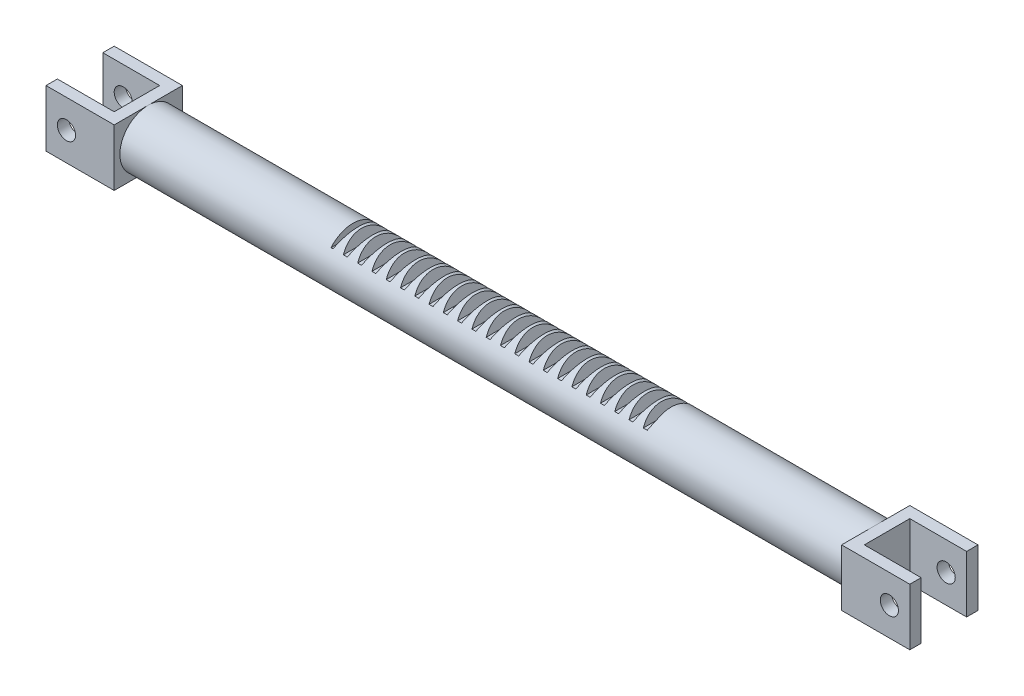
from build123d import *

# Parameters (mm, degrees)
BOSS_EXTRUDE1_DEPTH = 30
SKETCH2_R           = 30
SKETCH2_R_2         = 12.5
CUT_EXTRUDE1_DEPTH  = 146.129146151
BOSS_EXTRUDE2_START = 90
SKETCH3_R           = 12.5
BOSS_EXTRUDE2_DEPTH = 90
BOSS_EXTRUDE3_START = -140
SKETCH3_2_R         = 12.5
BOSS_EXTRUDE3_DEPTH = 90
SKETCH4_W           = 30
SKETCH4_H           = 25
BOSS_EXTRUDE4_DEPTH = 5
SKETCH8_W           = 30
SKETCH8_H           = 5
BOSS_EXTRUDE7_DEPTH = 25
SKETCH9_R           = 4
CUT_EXTRUDE2_DEPTH  = 242.111266906


with BuildPart() as part:
    # Sketch1 → Boss-Extrude1 (new body)
    with BuildSketch(Plane.XY):
        Polygon((20.439052972, 3.783569778), (18.715311494, 3.783569778), (17.077445439, 8.283569778), (15.793733726, 8.283569778), (14.155867672, 3.783569778), (12.432126194, 3.783569778), (10.794260139, 8.283569778), (9.510548426, 8.283569778), (7.872682372, 3.783569778), (6.148940894, 3.783569778), (4.511074839, 8.283569778), (3.227363126, 8.283569778), (1.589497072, 3.783569778), (-0.134244406, 3.783569778), (-1.772110461, 8.283569778), (-3.055822174, 8.283569778), (-4.693688228, 3.783569778), (-6.417429706, 3.783569778), (-8.055295761, 8.283569778), (-9.339007474, 8.283569778), (-10.976873528, 3.783569778), (-12.700615006, 3.783569778), (-14.338481061, 8.283569778), (-15.622192774, 8.283569778), (-17.260058828, 3.783569778), (-18.983800306, 3.783569778), (-20.621666361, 8.283569778), (-21.905378074, 8.283569778), (-23.543244128, 3.783569778), (-25.266985606, 3.783569778), (-26.904851661, 8.283569778), (-28.188563374, 8.283569778), (-29.826429428, 3.783569778), (-31.550170906, 3.783569778), (-33.188036961, 8.283569778), (-34.471748674, 8.283569778), (-36.109614728, 3.783569778), (-37.833356206, 3.783569778), (-39.471222261, 8.283569778), (-40.754933974, 8.283569778), (-42.392800028, 3.783569778), (-44.116541506, 3.783569778), (-45.754407561, 8.283569778), (-47.038119274, 8.283569778), (-48.675985328, 3.783569778), (-50.399726806, 3.783569778), (-52.037592861, 8.283569778), (-53.321304574, 8.283569778), (-54.959170628, 3.783569778), (-56.682912106, 3.783569778), (-58.320778161, 8.283569778), (-59.604489874, 8.283569778), (-61.242355928, 3.783569778), (-62.966097406, 3.783569778), (-64.603963461, 8.283569778), (-65.887675174, 8.283569778), (-67.525541228, 3.783569778), (-69.249282706, 3.783569778), (-70.887148761, 8.283569778), (-72.170860474, 8.283569778), (-73.808726528, 3.783569778), (-75.532468006, 3.783569778), (-77.170334061, 8.283569778), (-78.454045774, 8.283569778), (-80.091911828, 3.783569778), (-81.815653306, 3.783569778), (-83.453519361, 8.283569778), (-84.737231074, 8.283569778), (-86.375097128, 3.783569778), (-88.098838606, 3.783569778), (-89.736704661, 8.283569778), (-91.020416374, 8.283569778), (-92.658282428, 3.783569778), (-94.382023906, 3.783569778), (-96.019889961, 8.283569778), (-97.303601674, 8.283569778), (-98.941467728, 3.783569778), (-100.665209206, 3.783569778), (-102.303075261, 8.283569778), (-103.586786974, 8.283569778), (-105.224653028, 3.783569778), (-106.948394506, 3.783569778), (-108.586260561, 8.283569778), (-109.869972274, 8.283569778), (-111.507838328, 3.783569778), (-113.231579806, 3.783569778), (-114.869445861, 8.283569778), (-116.153157574, 8.283569778), (-117.791023628, 3.783569778), (-118.652894367, 3.783569778), (-118.652894367, -23.716430222), (21.347105633, -23.716430222), (21.347105633, 6.278423959), align=None)
    extrude(amount=BOSS_EXTRUDE1_DEPTH)

    # Sketch2 → Cut-Extrude1 (cut, through all)
    with BuildSketch(Plane.ZY.offset(118.652894367)):
        with Locations((15, -4.216430222)):
            Circle(SKETCH2_R)
        with Locations((15, -4.216430222)):
            Circle(SKETCH2_R_2, mode=Mode.SUBTRACT)
    extrude(amount=-CUT_EXTRUDE1_DEPTH, mode=Mode.SUBTRACT)

    # Sketch3 → Boss-Extrude2 (add)
    with BuildSketch(Plane.ZY.offset(118.652894367).offset(BOSS_EXTRUDE2_START)):
        with Locations((15, -4.216430222)):
            Circle(SKETCH3_R)
    extrude(amount=-BOSS_EXTRUDE2_DEPTH)

    # Sketch3<2> → Boss-Extrude3 (add)
    with BuildSketch(Plane.ZY.offset(118.652894367).offset(BOSS_EXTRUDE3_START)):
        with Locations((15, -4.216430222)):
            Circle(SKETCH3_2_R)
    extrude(amount=-BOSS_EXTRUDE3_DEPTH)

    # Sketch4 → Boss-Extrude4 (add)
    with BuildSketch(Plane.ZY.offset(208.652894367)):
        with Locations((15, -4.216430222)):
            Rectangle(SKETCH4_W, SKETCH4_H)
    boss_extrude4 = extrude(amount=BOSS_EXTRUDE4_DEPTH)

    # Sketch8 → Boss-Extrude7 (add)
    with BuildSketch(Plane(origin=(0, 8.283569778, 0), x_dir=(1, 0, 0), z_dir=(0, 1, 0))):
        with Locations((-223.652894367, -2.5)):
            Rectangle(SKETCH8_W, SKETCH8_H)
        with Locations((-223.652894367, -27.5)):
            Rectangle(SKETCH8_W, SKETCH8_H)
    boss_extrude7 = extrude(amount=-BOSS_EXTRUDE7_DEPTH)

    # Sketch9 → Cut-Extrude2 (cut, through all)
    with BuildSketch(Plane.XY.offset(30)):
        with Locations((-229.652894367, -4.216430222)):
            Circle(SKETCH9_R)
    cut_extrude2 = extrude(amount=-CUT_EXTRUDE2_DEPTH, mode=Mode.SUBTRACT)

    # Mirror1: Boss-Extrude4, Boss-Extrude7, Cut-Extrude2 across plane
    add(boss_extrude4.mirror(Plane(origin=(-48.652894367, 0, 0), x_dir=(0, 0, 1), z_dir=(1, 0, 0))))
    add(boss_extrude7.mirror(Plane(origin=(-48.652894367, 0, 0), x_dir=(0, 0, 1), z_dir=(1, 0, 0))))
    add(cut_extrude2.mirror(Plane(origin=(-48.652894367, 0, 0), x_dir=(0, 0, 1), z_dir=(1, 0, 0))), mode=Mode.SUBTRACT)


solid = part.part
